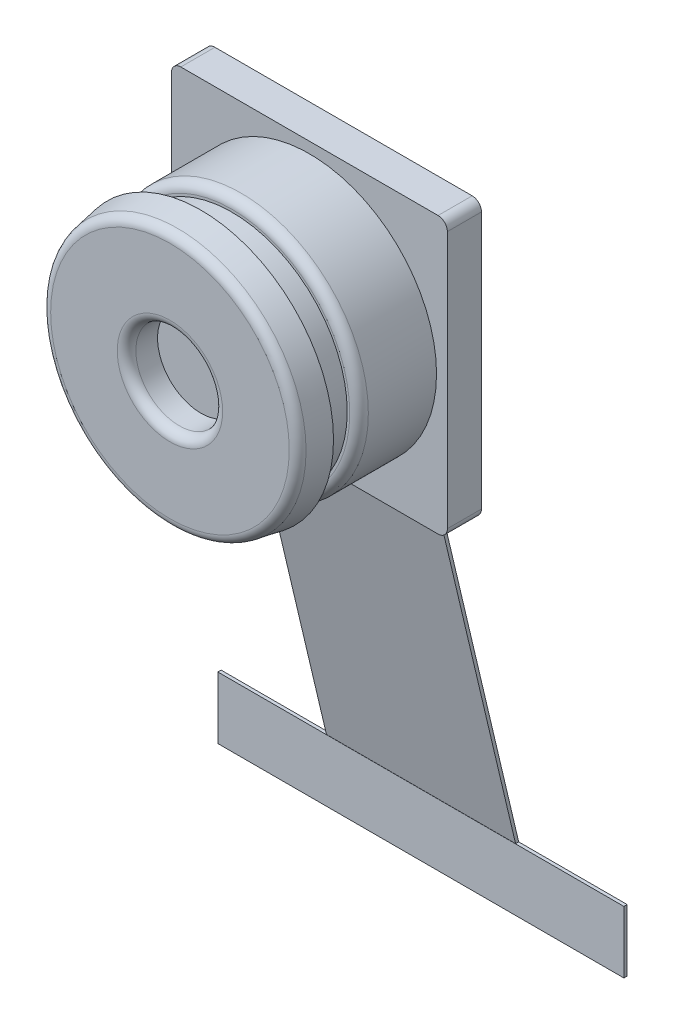
from build123d import *

# Parameters (mm, degrees)
EXTRUDE_633_DEPTH    = 0.1
SKETCH_2_W           = 8.9
SKETCH_2_H           = 8.9
EXTRUDE_2_DEPTH      = 1
SKETCH_3_R           = 4.1
EXTRUDE_3_DEPTH      = 2.5
SKETCH_4_R           = 3.719118072
EXTRUDE_4_DEPTH      = 2
SKETCH_5_R           = 4.1
EXTRUDE_5_DEPTH      = 1
EXTRUDE_5_DRAFT      = 10
SKETCH_6_R           = 1.4
CUT_EXTRUDE_1_DEPTH  = 1
FILLET_1_R           = 0.3
FILLET_2_R           = 0.3
FILLET_3_R           = 0.3
EXTRUDE_7_DEPTH      = 2.6
EXTRUDE_7_DEPTH_BACK = 0.1
CUT_EXTRUDE_4_REACH  = 21.211
CUT_EXTRUDE_5_REACH  = 23.178
SKETCH_13_W          = 2.594072948
SKETCH_13_H          = 2


with BuildPart() as part:
    # 草图1 → Extrude 633 (new body)
    with BuildSketch(Plane.XY):
        Polygon((2.653989215, -2.67), (4.053989215, -2.67), (4.053989215, 6.23), (-4.846010785, 6.23), (-4.846010785, -2.67), (-3.446010785, -2.67), (-3.446010785, -13.67), (-6.946010785, -13.67), (-6.946010785, -15.67), (6.153989215, -15.67), (6.153989215, -13.67), (2.653989215, -13.67), align=None)
    extrude(amount=EXTRUDE_633_DEPTH)

    # 草图2 → 凸台-拉伸2 (add)
    with BuildSketch(Plane.XY.offset(0.1)):
        with Locations((-0.396010785, 1.78)):
            Rectangle(SKETCH_2_W, SKETCH_2_H)
    extrude(amount=EXTRUDE_2_DEPTH)

    # 草图3 → 凸台-拉伸3 (add)
    with BuildSketch(Plane.XY.offset(1.1)):
        with Locations((-0.396010785, 1.78)):
            Circle(SKETCH_3_R)
    extrude(amount=EXTRUDE_3_DEPTH)

    # 草图4 → 凸台-拉伸4 (add)
    with BuildSketch(Plane.XY.offset(3.6)):
        with Locations((-0.396010785, 1.78)):
            Circle(SKETCH_4_R)
    extrude(amount=EXTRUDE_4_DEPTH)


with BuildPart() as extrude_5_tool:
    # 草图5 → 凸台-拉伸5 (with draft: the straight prism first)
    with BuildSketch(Plane.XY.offset(5.6)):
        with Locations((-0.396010785, 1.78)):
            Circle(SKETCH_5_R)
    extrude(amount=-EXTRUDE_5_DEPTH)
    # 凸台-拉伸5: the draft: its side faces are tilted about the plane it starts from
    extrude_5_sides = [extrude_5_tool.faces().sort_by_distance(p)[0] for p in [
        (-4.496010785, 1.78, 5.1),
    ]]
    draft(extrude_5_sides, Plane.XY.offset(5.6), EXTRUDE_5_DRAFT)


with BuildPart() as part_1:
    add(part.part)

    # 凸台-拉伸5: add extrude_5_tool
    add(extrude_5_tool.part)

    # 草图6 → 切除-拉伸1 (cut)
    with BuildSketch(Plane.XY.offset(5.6)):
        with Locations((-0.396010785, 1.78)):
            Circle(SKETCH_6_R)
    extrude(amount=-CUT_EXTRUDE_1_DEPTH, mode=Mode.SUBTRACT)

    # 圆角1
    fillet_1_edges = [part_1.edges().sort_by_distance(p)[0] for p in [
        (-4.496010785, 1.78, 3.6),
        (-4.496010785, 1.78, 5.6),
    ]]
    fillet(fillet_1_edges, radius=FILLET_1_R)

    # 圆角2
    fillet_2_edges = [part_1.edges().sort_by_distance(p)[0] for p in [
        (-4.846010785, 6.23, 0.55),
        (4.053989215, 6.23, 0.55),
        (4.053989215, -2.67, 0.55),
        (-4.846010785, -2.67, 0.55),
    ]]
    fillet(fillet_2_edges, radius=FILLET_2_R)

    # 圆角3
    fillet_3_edges = [part_1.edges().sort_by_distance(p)[0] for p in [
        (-1.796010785, 1.78, 5.6),
    ]]
    fillet(fillet_3_edges, radius=FILLET_3_R)

    # 草图11 → 凸台-拉伸7 (add, two sides: drawn at the far end of the back side and taken through both)
    with BuildSketch(Plane(origin=(0, 0, 0), x_dir=(-1, 0, 0), z_dir=(0, 0, -1)).offset(-EXTRUDE_7_DEPTH_BACK)):
        Polygon((-2.653989215, -13.67), (-6.153989215, -13.67), (-6.153989215, -15.67), (6.946010785, -15.67), (6.946010785, -13.67), (3.446010785, -13.67), (3.446010785, -2.67), (-2.653989215, -2.67), align=None)
    extrude(amount=EXTRUDE_7_DEPTH + EXTRUDE_7_DEPTH_BACK)

    # 草图12 → 切除-拉伸4 (cut, up to next)
    with BuildSketch(Plane.ZY.offset(3.446010785), mode=Mode.PRIVATE) as cut_extrude_4_sk1:
        Polygon((0, -2.67), (-2.6, -13.67), (-2.6, -2.67), align=None)
    cut_extrude_4_tool1 = extrude(cut_extrude_4_sk1.sketch, amount=-CUT_EXTRUDE_4_REACH, mode=Mode.PRIVATE) & part_1.part
    # 草图12 → 切除-拉伸4 (cut, up to next)
    with BuildSketch(Plane.ZY.offset(3.446010785), mode=Mode.PRIVATE) as cut_extrude_4_sk2:
        Polygon((0.1, -2.67), (-2.5, -13.67), (0.1, -13.67), align=None)
    cut_extrude_4_tool2 = extrude(cut_extrude_4_sk2.sketch, amount=-CUT_EXTRUDE_4_REACH, mode=Mode.PRIVATE) & part_1.part
    add(cut_extrude_4_tool1.solids().sort_by_distance((-3.446011, -6.336667, -1.733333))[0], mode=Mode.SUBTRACT)
    add(cut_extrude_4_tool2.solids().sort_by_distance((-3.446011, -10.003333, -0.766667))[0], mode=Mode.SUBTRACT)

    # 草图13 → 切除-拉伸5 (cut, up to next)
    with BuildSketch(Plane.ZY.offset(6.946010785), mode=Mode.PRIVATE) as cut_extrude_5_sk1:
        with Locations((-1.197036474, -14.67)):
            Rectangle(SKETCH_13_W, SKETCH_13_H)
    cut_extrude_5_tool1 = extrude(cut_extrude_5_sk1.sketch, amount=-CUT_EXTRUDE_5_REACH, mode=Mode.PRIVATE) & part_1.part
    add(cut_extrude_5_tool1.solids().sort_by_distance((-6.946011, -14.67, -1.197036))[0], mode=Mode.SUBTRACT)


solid = part_1.part
